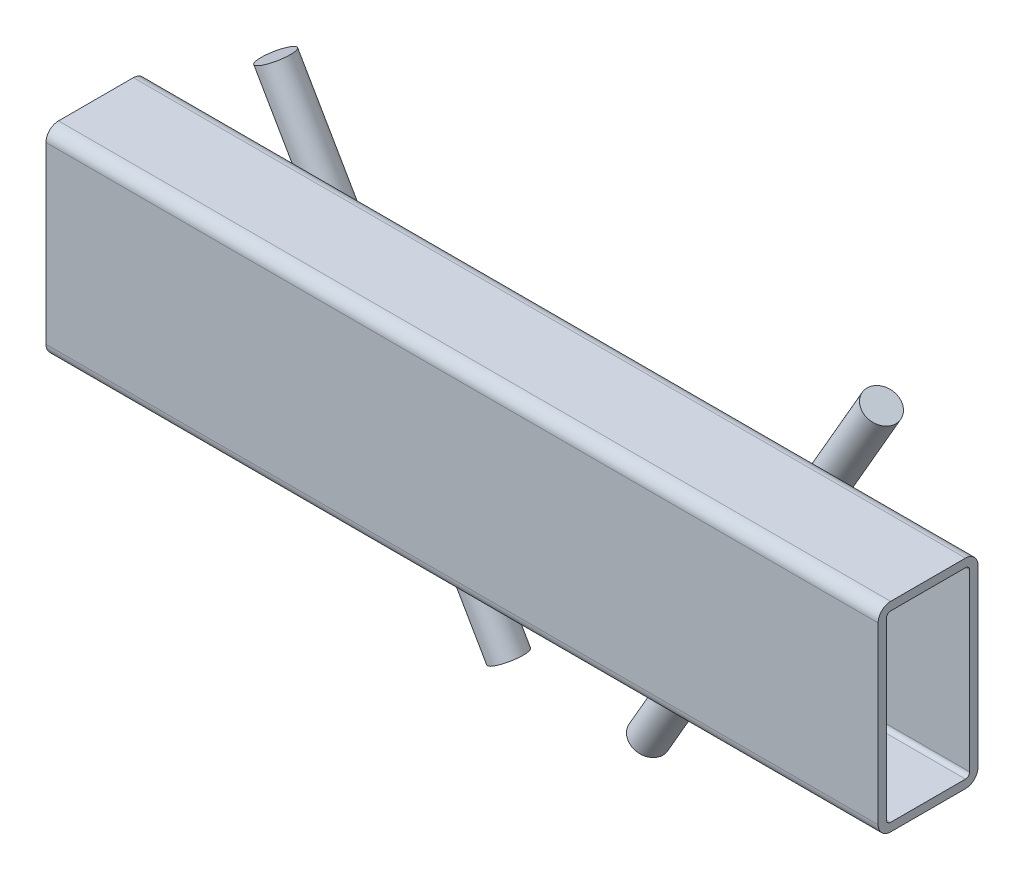
from build123d import *

# Parameters (mm, degrees)
AXBXS_8645_68_60_X_30_X_3_1_DEPTH = 250
SKETCH_4_R                        = 5


with BuildPart() as part:
    # Sketch1 → Труба axbxs гост8645-68 60 X 30 X 3(1) (new body)
    with BuildSketch(Plane(origin=(-125, 0, 0), x_dir=(0, 0, -1), z_dir=(1, 0, 0))):
        with BuildLine():
            Line((-11.25, -30), (11.25, -30))
            ThreePointArc((11.25, -30), (13.901650429, -28.901650429), (15, -26.25))
            Line((15, -26.25), (15, 26.25))
            ThreePointArc((15, 26.25), (13.901650429, 28.901650429), (11.25, 30))
            Line((11.25, 30), (-11.25, 30))
            ThreePointArc((-11.25, 30), (-13.901650429, 28.901650429), (-15, 26.25))
            Line((-15, 26.25), (-15, -26.25))
            ThreePointArc((-15, -26.25), (-13.901650429, -28.901650429), (-11.25, -30))
        make_face()
        with BuildLine():
            Line((-11.25, -27.5), (11.25, -27.5))
            ThreePointArc((11.25, -27.5), (12.133883476, -27.133883476), (12.5, -26.25))
            Line((12.5, -26.25), (12.5, 26.25))
            ThreePointArc((12.5, 26.25), (12.133883476, 27.133883476), (11.25, 27.5))
            Line((11.25, 27.5), (-11.25, 27.5))
            ThreePointArc((-11.25, 27.5), (-12.133883476, 27.133883476), (-12.5, 26.25))
            Line((-12.5, 26.25), (-12.5, -26.25))
            ThreePointArc((-12.5, -26.25), (-12.133883476, -27.133883476), (-11.25, -27.5))
        make_face(mode=Mode.SUBTRACT)
    extrude(amount=AXBXS_8645_68_60_X_30_X_3_1_DEPTH)


with BuildPart() as body_2:
    # По траектории1: sweep along a path in Эскиз3
    with BuildLine(Plane(origin=(0, 0, -20), x_dir=(-1, 0, 0), z_dir=(0, 0, -1))) as sweep_1_path:
        Line((21, -73), (91, 48.24355653))
    # Эскиз4 → По траектории1 (sweep)
    with BuildSketch(Plane(origin=(-21, -73, -20), x_dir=(0.8660254037844387, 0.4999999999999999, 0), z_dir=(-0.49999999999999994, 0.8660254037844388, 0))):
        Circle(SKETCH_4_R)
    sweep(path=sweep_1_path.line)


with BuildPart() as body_3:
    # Зеркальное отражение1: mirrored copy
    add(body_2.part.mirror(Plane(origin=(0, 0, 0), x_dir=(0, 0, 1), z_dir=(1, 0, 0))))


solid = Compound([part.part, body_2.part, body_3.part])
